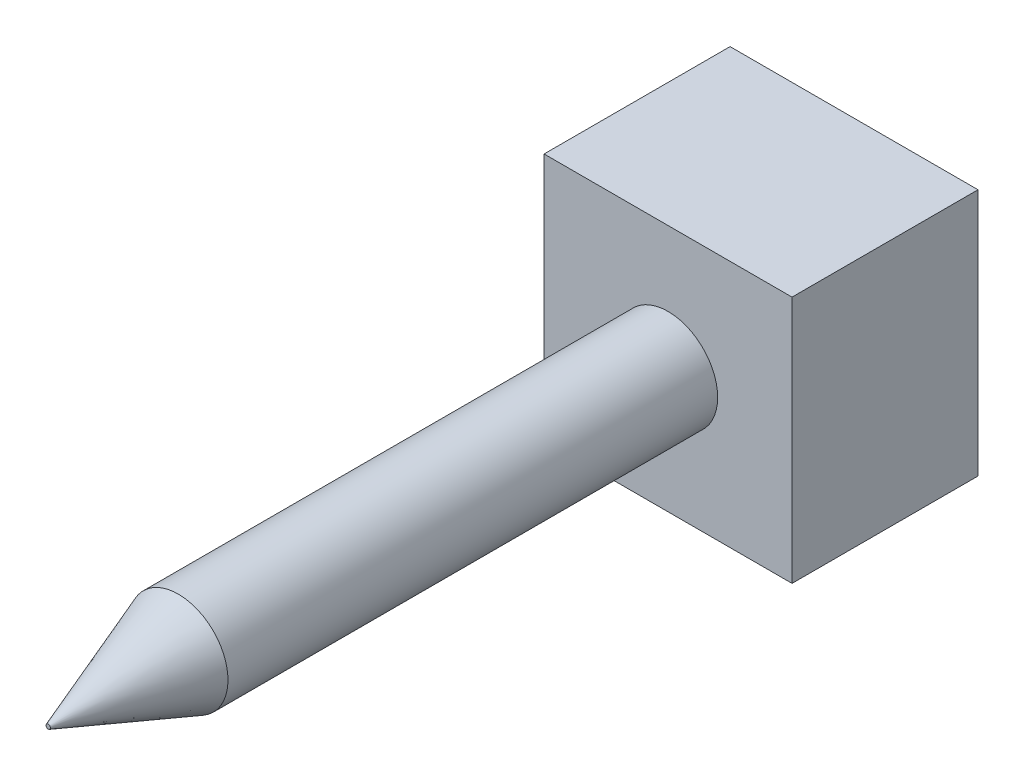
from build123d import *

# Parameters (mm, degrees)
SKETCH1_W           = 20
SKETCH1_H           = 20
BOSS_EXTRUDE1_DEPTH = 15
SKETCH2_R           = 4
BOSS_EXTRUDE2_DEPTH = 50
CHAMFER1_SIZE       = 10.5
CHAMFER1_SIZE2      = 3.82168746


with BuildPart() as part:
    # Sketch1 → Boss-Extrude1 (new body)
    with BuildSketch(Plane.XY):
        Rectangle(SKETCH1_W, SKETCH1_H)
    extrude(amount=BOSS_EXTRUDE1_DEPTH)

    # Sketch2 → Boss-Extrude2 (add)
    with BuildSketch(Plane.XY.offset(15)):
        Circle(SKETCH2_R)
    extrude(amount=BOSS_EXTRUDE2_DEPTH)

    # Chamfer1
    chamfer1_edges = [part.edges().sort_by_distance(p)[0] for p in [
        (-4, 0, 65),
    ]]
    chamfer1_side = [part.faces().sort_by_distance(p)[0] for p in [
        (-4, 0, 40),
    ]]
    chamfer(chamfer1_edges, length=CHAMFER1_SIZE, length2=CHAMFER1_SIZE2, reference=chamfer1_side[0])


solid = part.part
